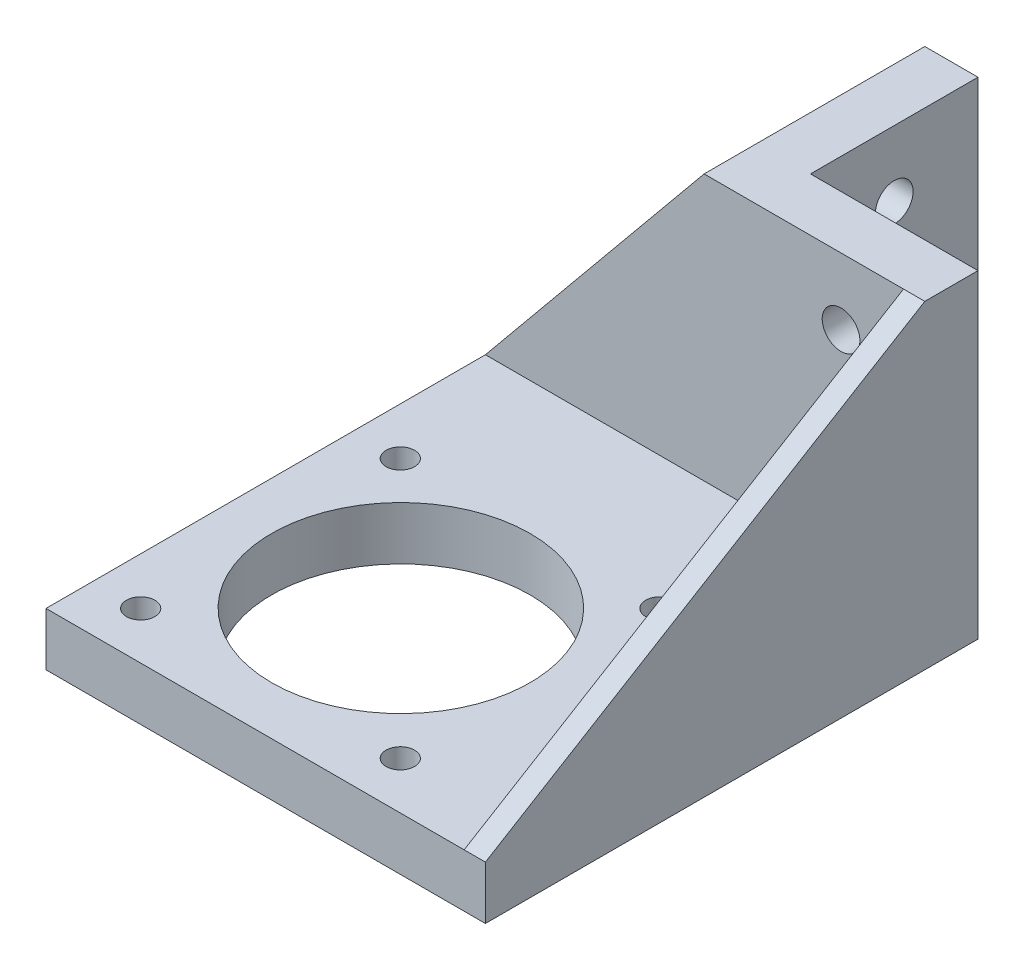
from build123d import *

# Parameters (mm, degrees)
SKETCH1_W            = 20
SKETCH1_H            = 6.35
SKETCH1_W_2          = 6.35
SKETCH1_H_2          = 20
BOSS_EXTRUDE1_DEPTH  = 38.1
SKETCH2_W            = 42.3
SKETCH2_H            = 10.16
SKETCH2_W_2          = 15.95
SKETCH2_H_2          = 26.35
SKETCH2_W_3          = 10.16
SKETCH2_H_3          = 52.46
BOSS_EXTRUDE3_DEPTH  = 6.35
SKETCH3_R            = 1.7
SKETCH3_R_2          = 15.431993428
CUT_EXTRUDE1_DEPTH   = 6.35
BOSS_EXTRUDE5_DEPTH  = 2.54
SKETCH6_W            = 10.16
SKETCH6_H            = 26.35
BOSS_EXTRUDE6_DEPTH  = 6.35
BOSS_EXTRUDE7_DEPTH  = 2.54
BOSS_EXTRUDE8_DEPTH  = 2.54
M4_CLEARANCE_HOLE2_D = 4.5
M4_CLEARANCE_HOLE3_D = 4.5


with BuildPart() as part:
    # Sketch1 → Boss-Extrude1 (new body)
    with BuildSketch(Plane(origin=(0, 0, 0), x_dir=(1, 0, 0), z_dir=(0, 1, 0))):
        with Locations((10, -3.175)):
            Rectangle(SKETCH1_W, SKETCH1_H)
        with Locations((-3.175, -3.175)):
            Rectangle(SKETCH1_W_2, SKETCH1_H)
        with Locations((-3.175, 10)):
            Rectangle(SKETCH1_W_2, SKETCH1_H_2)
    extrude(amount=BOSS_EXTRUDE1_DEPTH)

    # Sketch2 → Boss-Extrude3 (add)
    with BuildSketch(Plane.XZ):
        Polygon((-6.35, 6.35), (20, 6.35), (20, 48.65), (-22.3, 48.65), (-22.3, 6.35), align=None)
        with Locations((-1.15, 53.73)):
            Rectangle(SKETCH2_W, SKETCH2_H)
        with Locations((-14.325, -6.825)):
            Rectangle(SKETCH2_W_2, SKETCH2_H_2)
        with Locations((-27.38, 32.58)):
            Rectangle(SKETCH2_W_3, SKETCH2_H_3)
    extrude(amount=-BOSS_EXTRUDE3_DEPTH)

    # Sketch3 → Cut-Extrude1 (cut)
    with BuildSketch(Plane(origin=(0, 6.35, 0), x_dir=(1, 0, 0), z_dir=(0, 1, 0))):
        with Locations(Location((4.19, -22.16, 0), (0, 0, 270))):
            Circle(SKETCH3_R)
        with Locations(Location((-26.81, -53.16, 0), (0, 0, 270))):
            Circle(SKETCH3_R)
        with Locations(Location((-26.81, -22.16, 0), (0, 0, 270))):
            Circle(SKETCH3_R)
        with Locations(Location((-11.314321333, -37.591993428, 0), (0, 0, 270))):
            Circle(SKETCH3_R_2)
        with Locations(Location((4.19, -53.16, 0), (0, 0, 270))):
            Circle(SKETCH3_R)
    extrude(amount=-CUT_EXTRUDE1_DEPTH, mode=Mode.SUBTRACT)

    # Sketch5 → Boss-Extrude5 (add)
    with BuildSketch(Plane(origin=(20, 0, 0), x_dir=(0, 0, -1), z_dir=(1, 0, 0))):
        Polygon((-6.35, 38.1), (-58.81, 6.35), (-6.35, 6.35), align=None)
    extrude(amount=-BOSS_EXTRUDE5_DEPTH)

    # Sketch6 → Boss-Extrude6 (add)
    with BuildSketch(Plane(origin=(0, 6.35, 0), x_dir=(1, 0, 0), z_dir=(0, 1, 0))):
        with Locations((-27.38, 6.825)):
            Rectangle(SKETCH6_W, SKETCH6_H)
    extrude(amount=-BOSS_EXTRUDE6_DEPTH)

    # Sketch7 → Boss-Extrude7 (add)
    with BuildSketch(Plane(origin=(0, 0, -20), x_dir=(-1, 0, 0), z_dir=(0, 0, -1))):
        Polygon((6.35, 38.1), (32.46, 6.35), (6.35, 6.35), align=None)
    extrude(amount=-BOSS_EXTRUDE7_DEPTH)

    # Sketch8 → Boss-Extrude8 (add)
    with BuildSketch(Plane.XY.offset(6.35)):
        Polygon((-6.35, 38.1), (-32.46, 6.35), (-6.35, 6.35), align=None)
    extrude(amount=-BOSS_EXTRUDE8_DEPTH)

    # M4 Clearance Hole2 (through all)
    with Locations(Plane.ZY.offset(6.35)):
        with Locations((-10, 30.1625), (-10, 14.2875)):
            Hole(M4_CLEARANCE_HOLE2_D / 2)

    # M4 Clearance Hole3 (through all)
    with Locations(Plane.XY.offset(6.35)):
        with Locations((10, 30.1625), (10, 14.2875)):
            Hole(M4_CLEARANCE_HOLE3_D / 2)


solid = part.part
